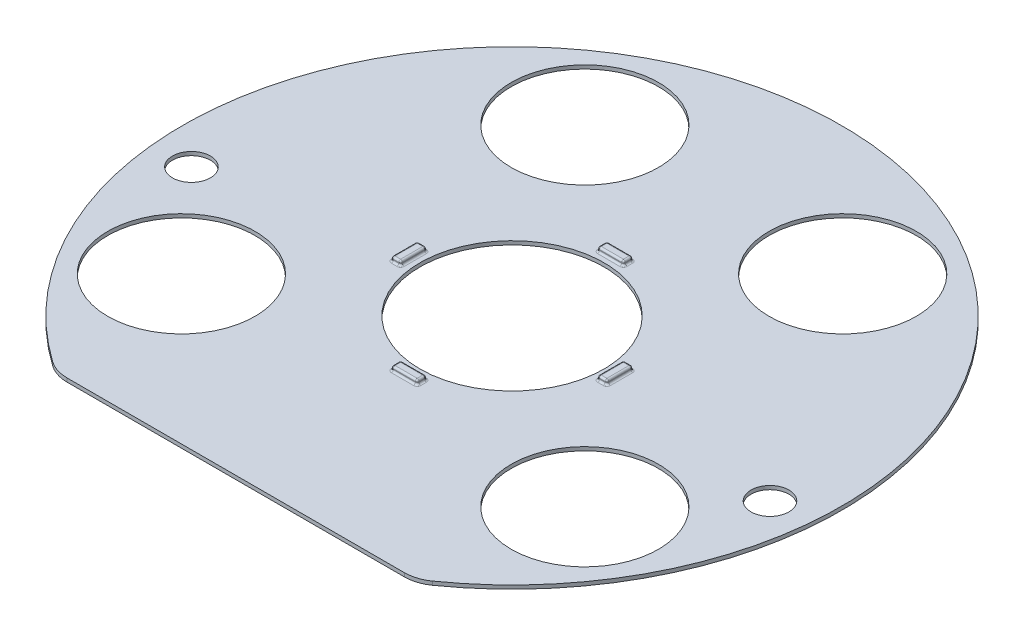
from build123d import *

# Parameters (mm, degrees)
BOSS_EXTRUDE1_DEPTH = 1
SKETCH9_R           = 5.15
CUT_EXTRUDE3_DEPTH  = 127.576064088
VISION_PATTERN_R    = 25
VISION_PATTERN_R_2  = 20
CUT_EXTRUDE4_DEPTH  = 127.576064088
FILLET1_R           = 10
SKETCH10_W          = 7
SKETCH10_H          = 2.5
SKETCH10_W_2        = 2.5
SKETCH10_H_2        = 7
BOSS_EXTRUDE2_DEPTH = 1.2
FILLET2_R           = 0.5


with BuildPart() as part:
    # Sketch1 → Boss-Extrude1 (new body)
    with BuildSketch(Plane(origin=(0, 0, 0), x_dir=(1, 0, 0), z_dir=(0, 1, 0))):
        with BuildLine():
            Line((-48.839021284, -75), (48.839021284, -75))
            ThreePointArc((48.839021284, -75), (0, 89.5), (-48.839021284, -75))
        make_face()
    extrude(amount=-BOSS_EXTRUDE1_DEPTH)

    # Sketch9 → Cut-Extrude3 (cut, through all)
    with BuildSketch(Plane(origin=(0, 0, 0), x_dir=(1, 0, 0), z_dir=(0, 1, 0))):
        with Locations(Location((78.541209232, -8.501673503, 0), (0, 0, 270))):
            Circle(SKETCH9_R)
        with Locations(Location((-78.541209232, -8.501673503, 0), (0, 0, 270))):
            Circle(SKETCH9_R)
    extrude(amount=-CUT_EXTRUDE3_DEPTH, mode=Mode.SUBTRACT)

    # Vision Pattern → Cut-Extrude4 (cut, through all)
    with BuildSketch(Plane(origin=(0, 0, 0), x_dir=(1, 0, 0), z_dir=(0, 1, 0))):
        with Locations(Location((0, 0, 0), (0, 0, 270))):
            Circle(VISION_PATTERN_R)
        with Locations(Location((54.772255751, -35, 0), (0, 0, 270))):
            Circle(VISION_PATTERN_R_2)
        with Locations(Location((-54.772255751, -35, 0), (0, 0, 270))):
            Circle(VISION_PATTERN_R_2)
        with Locations(Location((35, 54.772255751, 0), (0, 0, 270))):
            Circle(VISION_PATTERN_R_2)
        with Locations(Location((-35, 54.772255751, 0), (0, 0, 270))):
            Circle(VISION_PATTERN_R_2)
    extrude(amount=-CUT_EXTRUDE4_DEPTH, mode=Mode.SUBTRACT)

    # Fillet1
    fillet1_edges = [part.edges().sort_by_distance(p)[0] for p in [
        (48.839021284, -0.5, 75),
        (-48.839021284, -0.5, 75),
    ]]
    fillet(fillet1_edges, radius=FILLET1_R)

    # Sketch10 → Boss-Extrude2 (add)
    with BuildSketch(Plane(origin=(0, 0, 0), x_dir=(1, 0, 0), z_dir=(0, 1, 0))):
        with Locations((0, 28)):
            Rectangle(SKETCH10_W, SKETCH10_H)
        with Locations((-28, 0)):
            Rectangle(SKETCH10_W_2, SKETCH10_H_2)
        with Locations((28, 0)):
            Rectangle(SKETCH10_W_2, SKETCH10_H_2)
        with Locations((0, -28)):
            Rectangle(SKETCH10_W, SKETCH10_H)
    extrude(amount=BOSS_EXTRUDE2_DEPTH)

    # Fillet2
    fillet2_edges = [part.edges().sort_by_distance(p)[0] for p in [
        (-29.25, 0, 0),
        (-29.25, 0.6, -3.5),
        (-28, 0, 3.5),
        (-29.25, 0.6, 3.5),
        (-26.75, 0, 0),
        (-26.75, 0.6, 3.5),
        (-28, 0, -3.5),
        (-26.75, 0.6, -3.5),
        (-29.25, 1.2, 0),
        (-28, 1.2, 3.5),
        (-26.75, 1.2, 0),
        (-28, 1.2, -3.5),
        (-3.5, 0, -28),
        (-3.5, 0.6, -29.25),
        (0, 0, -26.75),
        (-3.5, 0.6, -26.75),
        (3.5, 0, -28),
        (3.5, 0.6, -26.75),
        (0, 0, -29.25),
        (3.5, 0.6, -29.25),
        (-3.5, 1.2, -28),
        (0, 1.2, -26.75),
        (3.5, 1.2, -28),
        (0, 1.2, -29.25),
        (28, 0, -3.5),
        (29.25, 0.6, -3.5),
        (26.75, 0, 0),
        (26.75, 0.6, -3.5),
        (28, 0, 3.5),
        (26.75, 0.6, 3.5),
        (29.25, 0, 0),
        (29.25, 0.6, 3.5),
        (28, 1.2, -3.5),
        (26.75, 1.2, 0),
        (28, 1.2, 3.5),
        (29.25, 1.2, 0),
        (3.5, 0, 28),
        (3.5, 0.6, 29.25),
        (0, 0, 26.75),
        (3.5, 0.6, 26.75),
        (-3.5, 0, 28),
        (-3.5, 0.6, 26.75),
        (0, 0, 29.25),
        (-3.5, 0.6, 29.25),
        (3.5, 1.2, 28),
        (0, 1.2, 26.75),
        (-3.5, 1.2, 28),
        (0, 1.2, 29.25),
    ]]
    fillet(fillet2_edges, radius=FILLET2_R)


solid = part.part
